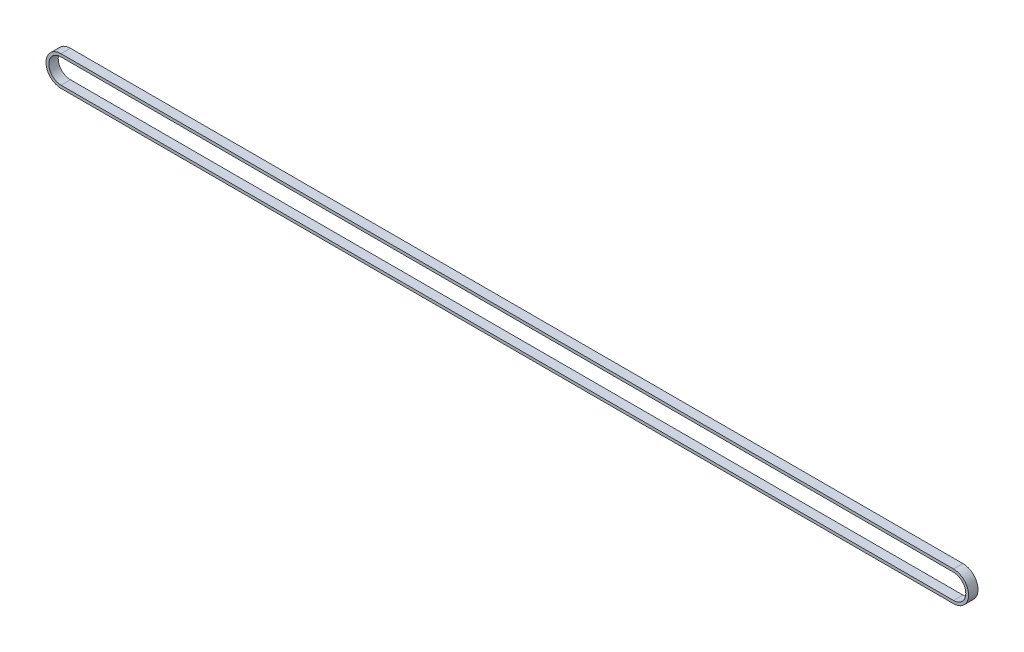
from build123d import *

# Parameters (mm, degrees)
BOSS_EXTRUDE1_DEPTH = 5


with BuildPart() as part:
    # Sketch1 → Boss-Extrude1 (new body)
    with BuildSketch(Plane.XY):
        with BuildLine():
            Line((0, 8), (474.5, 8))
            ThreePointArc((474.5, 8), (482.5, 0), (474.5, -8))
            Line((474.5, -8), (0, -8))
            ThreePointArc((0, -8), (-8, 0), (0, 8))
        make_face()
        with BuildLine():
            Line((0, 6.5), (474.5, 6.5))
            ThreePointArc((474.5, 6.5), (481, 0), (474.5, -6.5))
            Line((474.5, -6.5), (0, -6.5))
            ThreePointArc((0, -6.5), (-6.5, 0), (0, 6.5))
        make_face(mode=Mode.SUBTRACT)
    extrude(amount=BOSS_EXTRUDE1_DEPTH)


solid = part.part
